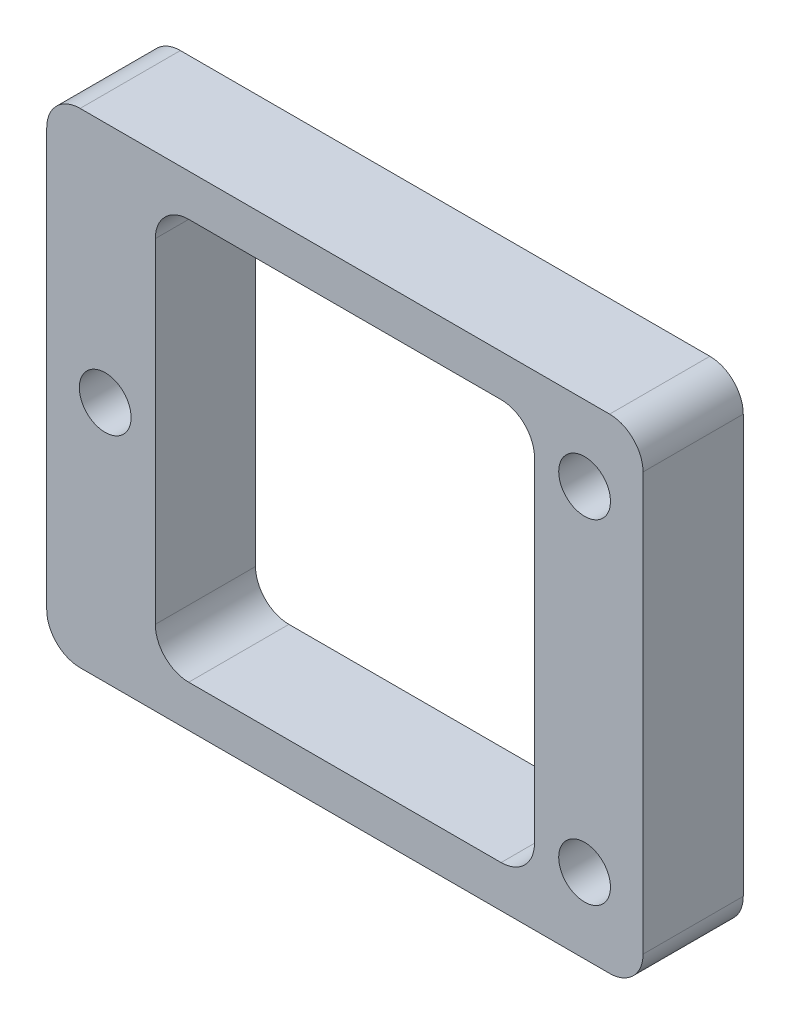
from build123d import *

# Parameters (mm, degrees)
SKETCH_1_W          = 35.7
SKETCH_1_H          = 29
EXTRUDE_1_DEPTH     = 6
SKETCH_2_R          = 1.55
CUT_EXTRUDE_1_DEPTH = 6
SKETCH_3_W          = 22.7
SKETCH_3_H          = 24
CUT_EXTRUDE_2_DEPTH = 10
FILLET_1_R          = 2


with BuildPart() as part:
    # 草图1 → 凸台-拉伸1 (new body)
    with BuildSketch(Plane.XY):
        Rectangle(SKETCH_1_W, SKETCH_1_H)
    extrude(amount=EXTRUDE_1_DEPTH)

    # 草图2 → 切除-拉伸1 (cut)
    with BuildSketch(Plane(origin=(0, 0, 0), x_dir=(-1, 0, 0), z_dir=(0, 0, -1))):
        with Locations((14.35, 0)):
            Circle(SKETCH_2_R)
        with Locations((-14.35, 10)):
            Circle(SKETCH_2_R)
        with Locations((-14.35, -10)):
            Circle(SKETCH_2_R)
    extrude(amount=-CUT_EXTRUDE_1_DEPTH, mode=Mode.SUBTRACT)

    # 草图3 → 切除-拉伸2 (cut)
    with BuildSketch(Plane(origin=(0, 0, 0), x_dir=(-1, 0, 0), z_dir=(0, 0, -1))):
        Rectangle(SKETCH_3_W, SKETCH_3_H)
    extrude(amount=-CUT_EXTRUDE_2_DEPTH, mode=Mode.SUBTRACT)

    # 圆角1
    fillet_1_edges = [part.edges().sort_by_distance(p)[0] for p in [
        (-11.35, 12, 3),
        (-11.35, -12, 3),
        (11.35, -12, 3),
        (11.35, 12, 3),
        (17.85, -14.5, 3),
        (-17.85, -14.5, 3),
        (-17.85, 14.5, 3),
        (17.85, 14.5, 3),
    ]]
    fillet(fillet_1_edges, radius=FILLET_1_R)


solid = part.part
